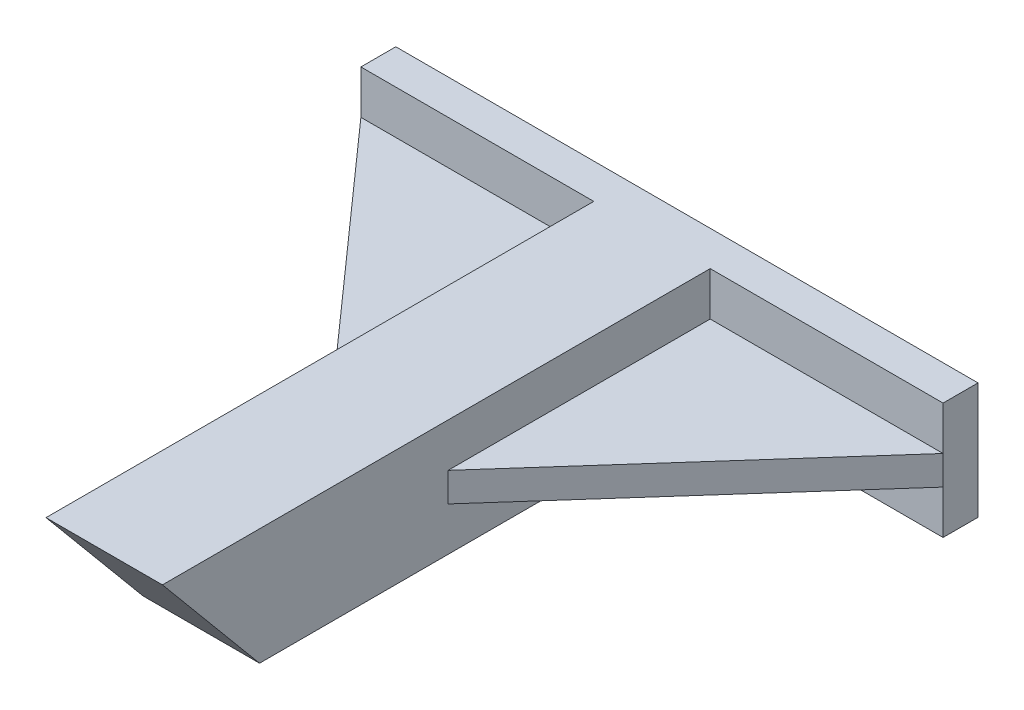
from build123d import *

# Parameters (mm, degrees)
AUFSATZ_LINEAR_AUSTRAGEN1_DEPTH = 20
SKIZZE2_W                       = 100
SKIZZE2_H                       = 6
AUFSATZ_LINEAR_AUSTRAGEN2_DEPTH = 20
AUFSATZ_LINEAR_AUSTRAGEN3_DEPTH = 2.5


with BuildPart() as part:
    # Skizze1 → Aufsatz-Linear austragen1 (new body)
    with BuildSketch(Plane.ZY):
        Polygon((75, 100), (75, 120), (175.086059804, 120), (158.405049837, 100), align=None)
    extrude(amount=-AUFSATZ_LINEAR_AUSTRAGEN1_DEPTH)

    # Skizze2 → Aufsatz-Linear austragen2 (add)
    with BuildSketch(Plane(origin=(0, 120, 0), x_dir=(1, 0, 0), z_dir=(0, 1, 0))):
        with Locations((10, -78)):
            Rectangle(SKIZZE2_W, SKIZZE2_H)
    extrude(amount=-AUFSATZ_LINEAR_AUSTRAGEN2_DEPTH)

    # Skizze3 → Aufsatz-Linear austragen3 (add, symmetric)
    with BuildSketch(Plane(origin=(0, 110, 0), x_dir=(1, 0, 0), z_dir=(0, 1, 0))):
        Polygon((-40, -81), (0, -126.018077963), (20, -126.018077963), (60, -81), align=None)
    extrude(amount=AUFSATZ_LINEAR_AUSTRAGEN3_DEPTH, both=True)


solid = part.part
